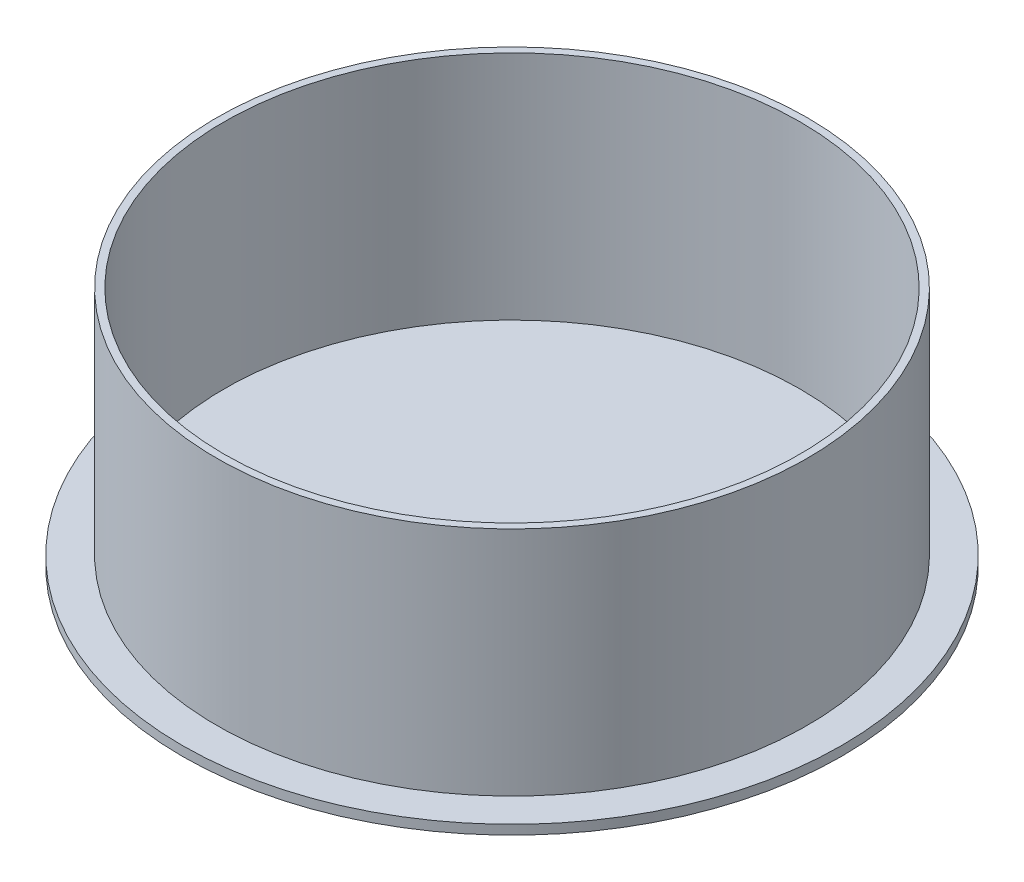
from build123d import *


with BuildPart() as part:
    # Croquis1 → Revolución1 (revolve)
    with BuildSketch(Plane.XY, mode=Mode.PRIVATE) as revoluci_n1_sk:
        Polygon((-77.724, 62.46), (-77.724, 0), (0, 0), (0, -2.54), (-89, -2.54), (-89, 0), (-79.6798, 0), (-79.6798, 62.46), align=None)
    revolve(revoluci_n1_sk.sketch.rotate(Axis((0, 0, 0), (0, 1, 0)), 270), axis=Axis((0, 0, 0), (0, 1, 0)))


solid = part.part
